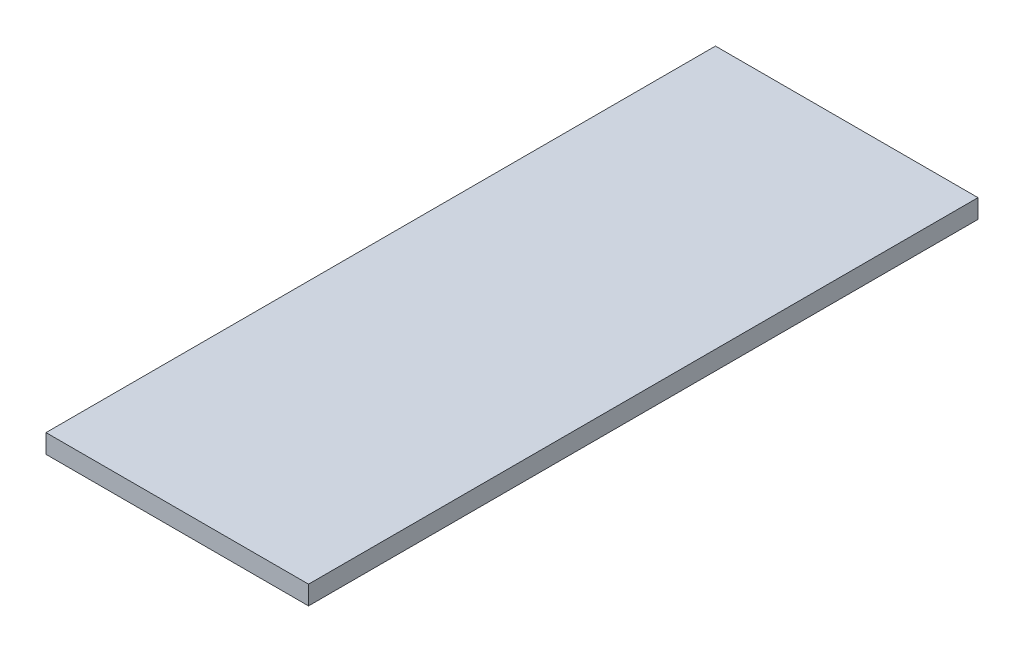
from build123d import *

# Parameters (mm, degrees)
SKETCH1_W           = 254
SKETCH1_H           = 647.7
BOSS_EXTRUDE1_DEPTH = 18.25625


with BuildPart() as part:
    # Sketch1 → Boss-Extrude1 (new body)
    with BuildSketch(Plane(origin=(0, 0, 0), x_dir=(1, 0, 0), z_dir=(0, 1, 0))):
        with Locations((0, 114.3)):
            Rectangle(SKETCH1_W, SKETCH1_H)
    extrude(amount=BOSS_EXTRUDE1_DEPTH)


solid = part.part
